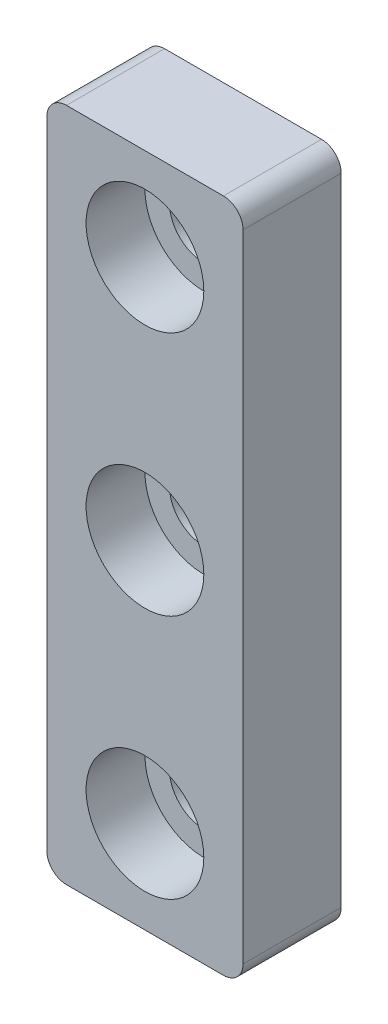
from build123d import *

# Parameters (mm, degrees)
SKETCH1_W           = 10
SKETCH1_H           = 34.4
BOSS_EXTRUDE1_DEPTH = 5
FILLET1_R           = 1
SKETCH4_R           = 1.75
CUT_EXTRUDE1_DEPTH  = 5
SKETCH5_R           = 3
CUT_EXTRUDE2_DEPTH  = 3


with BuildPart() as part:
    # Sketch1 → Boss-Extrude1 (new body)
    with BuildSketch(Plane.XY):
        Rectangle(SKETCH1_W, SKETCH1_H)
    extrude(amount=BOSS_EXTRUDE1_DEPTH)

    # Fillet1
    fillet1_edges = [part.edges().sort_by_distance(p)[0] for p in [
        (-5, 17.2, 2.5),
        (5, 17.2, 2.5),
        (5, -17.2, 2.5),
        (-5, -17.2, 2.5),
    ]]
    fillet(fillet1_edges, radius=FILLET1_R)

    # Sketch4 → Cut-Extrude1 (cut)
    with BuildSketch(Plane.XY.offset(5)):
        Circle(SKETCH4_R)
        with Locations((0, 12.5)):
            Circle(SKETCH4_R)
        with Locations((0, -12.5)):
            Circle(SKETCH4_R)
    extrude(amount=-CUT_EXTRUDE1_DEPTH, mode=Mode.SUBTRACT)

    # Sketch5 → Cut-Extrude2 (cut)
    with BuildSketch(Plane.XY.offset(5)):
        with Locations((0, 12.5)):
            Circle(SKETCH5_R)
        Circle(SKETCH5_R)
        with Locations((0, -12.5)):
            Circle(SKETCH5_R)
    extrude(amount=-CUT_EXTRUDE2_DEPTH, mode=Mode.SUBTRACT)


solid = part.part
